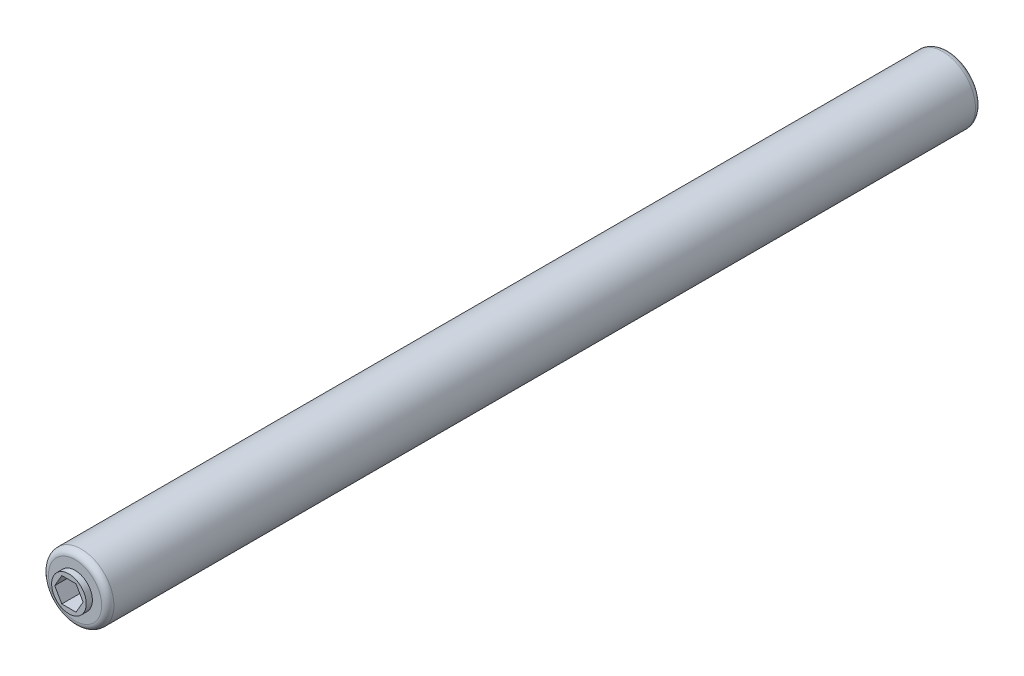
from build123d import *

# Parameters (mm, degrees)
SKETCH1_R           = 16.8671875
BOSS_EXTRUDE1_DEPTH = 228.6
SKETCH2_W           = 7.9375
SKETCH2_H           = 3.175
FILLET1_R           = 3.175
CUT_EXTRUDE1_DEPTH  = 458.821847482


with BuildPart() as part:
    # Sketch1 → Boss-Extrude1 (new, symmetric)
    with BuildSketch(Plane.XY):
        Circle(SKETCH1_R)
    extrude(amount=BOSS_EXTRUDE1_DEPTH, both=True)

    # Sketch2 → Cut-Revolve1 (revolve, cut)
    with BuildSketch(Plane(origin=(0, 0, 0), x_dir=(1, 0, 0), z_dir=(0, 1, 0))):
        with Locations((12.8984375, -227.0125)):
            Rectangle(SKETCH2_W, SKETCH2_H)
        with Locations((12.8984375, 227.0125)):
            Rectangle(SKETCH2_W, SKETCH2_H)
    revolve(axis=Axis((0, 0, 0), (0, 0, -1)), mode=Mode.SUBTRACT)

    # Fillet1
    fillet1_edges = [part.edges().sort_by_distance(p)[0] for p in [
        (-16.8671875, 0, -225.425),
        (-16.8671875, 0, 225.425),
    ]]
    fillet(fillet1_edges, radius=FILLET1_R)

    # Sketch3 → Cut-Extrude1 (cut, through all)
    with BuildSketch(Plane.XY.offset(228.6)):
        Polygon((7.332348419, 0), (3.666174209, 6.35), (-3.666174209, 6.35), (-7.332348419, 0), (-3.666174209, -6.35), (3.666174209, -6.35), align=None)
    extrude(amount=-CUT_EXTRUDE1_DEPTH, mode=Mode.SUBTRACT)


solid = part.part
